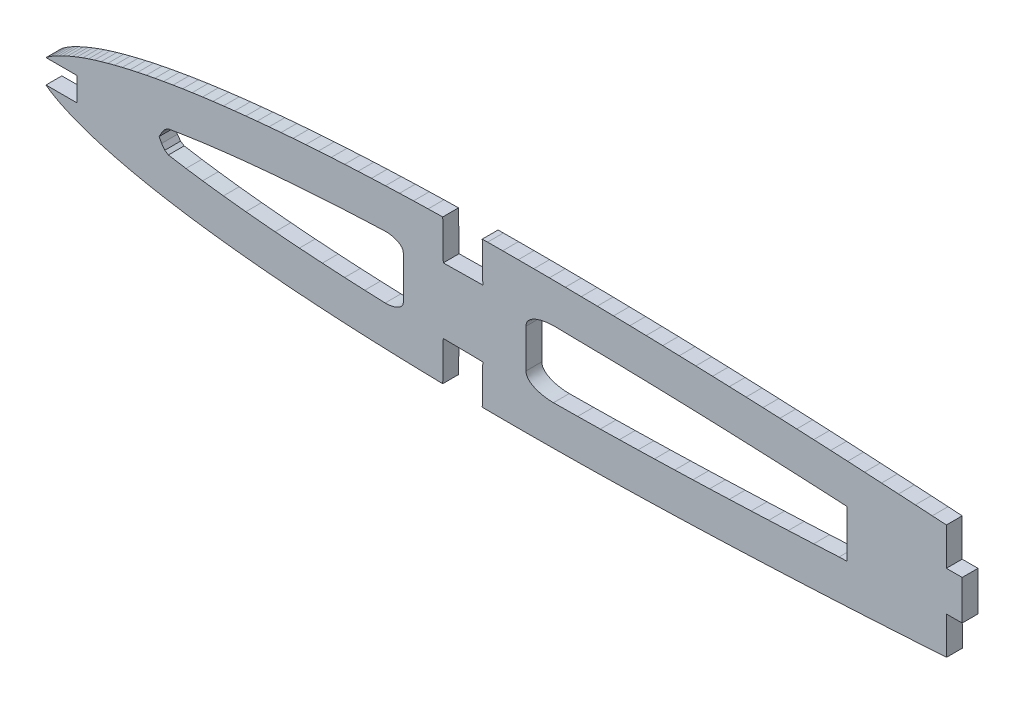
from build123d import *

# Parameters (mm, degrees)
EXTRUDE_1_DEPTH = 2


with BuildPart() as part:
    # Model → 凸台-拉伸1 (new body)
    with BuildSketch(Plane.XY):
        Polygon((163.647124705, -193.625837396), (167.570015682, -193.625837396), (167.570015682, -196.625837396), (163.648140211, -196.625837396), (163.699015682, -196.667837396), (164.036015682, -196.913837396), (164.386015682, -197.142837396), (164.844015682, -197.411837396), (165.313015682, -197.659837396), (165.790015682, -197.892837396), (166.383015682, -198.164837396), (166.981015682, -198.421837396), (167.586015682, -198.663837396), (168.307015682, -198.931837396), (169.035015682, -199.182837396), (169.767015682, -199.417837396), (170.616015682, -199.672837396), (171.469015682, -199.911837396), (172.326015682, -200.137837396), (173.297015682, -200.378837396), (174.271015682, -200.605837396), (175.249015682, -200.819837396), (176.339015682, -201.044837396), (177.432015682, -201.254837396), (178.527015682, -201.453837396), (179.731015682, -201.658837396), (180.937015682, -201.851837396), (182.145015682, -202.033837396), (183.459015682, -202.218837396), (184.774015682, -202.391837396), (186.091015682, -202.554837396), (187.510015682, -202.717837396), (188.930015682, -202.869837396), (190.351015682, -203.011837396), (191.868015682, -203.152837396), (193.385015682, -203.283837396), (194.904015682, -203.404837396), (196.513015682, -203.523837396), (198.123015682, -203.631837396), (199.733015682, -203.730837396), (201.429015682, -203.825837396), (203.125015682, -203.910837396), (204.821015682, -203.987837396), (206.596015682, -204.058837396), (208.371015682, -204.121837396), (210.147015682, -204.175837396), (211.994015682, -204.224837396), (213.841015682, -204.264837396), (213.909015682, -199.264837396), (218.909015682, -199.333837396), (218.840015682, -204.333837396), (219.513015682, -204.339837396), (221.426015682, -204.349837396), (223.396015682, -204.353837396), (225.366015682, -204.349837396), (227.336015682, -204.339837396), (229.355015682, -204.322837396), (231.374015682, -204.298837396), (233.393015682, -204.267837396), (235.455015682, -204.230837396), (237.515015682, -204.186837396), (239.576015682, -204.136837396), (241.671015682, -204.080837396), (243.766015682, -204.019837396), (245.861015682, -203.952837396), (247.981015682, -203.878837396), (250.100015682, -203.800837396), (252.220015682, -203.716837396), (254.358015682, -203.627837396), (256.495015682, -203.534837396), (258.632015682, -203.435837396), (260.778015682, -203.332837396), (262.922015682, -203.223837396), (265.067015682, -203.109837396), (267.212015682, -202.990837396), (269.357015682, -202.868837396), (271.502015682, -202.742837396), (273.640015682, -202.616837396), (275.777015682, -202.486837396), (277.580832126, -202.374573668), (277.564036383, -197.625837396), (279.564036383, -197.625837396), (279.564036383, -195.125837396), (279.564036383, -192.625837396), (277.564036383, -192.625837396), (277.564036383, -187.87589204), (275.777015682, -187.763837396), (273.640015682, -187.634837396), (271.502015682, -187.507837396), (269.357015682, -187.382837396), (267.212015682, -187.259837396), (265.067015682, -187.140837396), (262.922015682, -187.026837396), (260.778015682, -186.918837396), (258.632015682, -186.814837396), (256.495015682, -186.716837396), (254.358015682, -186.622837396), (252.220015682, -186.533837396), (250.100015682, -186.450837396), (247.981015682, -186.371837396), (245.861015682, -186.298837396), (243.766015682, -186.231837396), (241.671015682, -186.169837396), (239.576015682, -186.113837396), (237.515015682, -186.064837396), (235.455015682, -186.020837396), (233.393015682, -185.982837396), (231.374015682, -185.951837396), (229.355015682, -185.928837396), (227.336015682, -185.910837396), (225.366015682, -185.900837396), (223.396015682, -185.897837396), (221.426015682, -185.900837396), (219.513015682, -185.910837396), (218.840623844, -185.917828954), (218.910015682, -190.916837396), (213.910015682, -190.985837396), (213.841015682, -185.986837396), (211.994015682, -186.026837396), (210.147015682, -186.074837396), (208.371015682, -186.129837396), (206.596015682, -186.192837396), (204.821015682, -186.263837396), (203.125015682, -186.339837396), (201.429015682, -186.425837396), (199.733015682, -186.519837396), (198.123015682, -186.618837396), (196.513015682, -186.727837396), (194.904015682, -186.845837396), (193.385015682, -186.966837396), (191.868015682, -187.097837396), (190.351015682, -187.239837396), (188.930015682, -187.381837396), (187.510015682, -187.533837396), (186.091015682, -187.696837396), (184.774015682, -187.858837396), (183.459015682, -188.031837396), (182.145015682, -188.216837396), (180.937015682, -188.398837396), (179.731015682, -188.591837396), (178.527015682, -188.797837396), (177.432015682, -188.995837396), (176.339015682, -189.206837396), (175.249015682, -189.430837396), (174.271015682, -189.644837396), (173.297015682, -189.872837396), (172.326015682, -190.113837396), (171.469015682, -190.338837396), (170.616015682, -190.577837396), (169.767015682, -190.832837396), (169.035015682, -191.068837396), (168.307015682, -191.318837396), (167.586015682, -191.587837396), (166.981015682, -191.829837396), (166.383015682, -192.086837396), (165.790015682, -192.357837396), (165.313015682, -192.591837396), (164.844015682, -192.839837396), (164.386015682, -193.108837396), (164.036015682, -193.336837396), (163.699015682, -193.582837396), align=None)
        with BuildLine():
            Line((179.129015682, -193.694837396), (181.36252465, -193.334729257))
            Line((181.36252465, -193.334729257), (183.459015682, -193.031837396))
            Line((183.459015682, -193.031837396), (186.091015682, -192.696837396))
            Line((186.091015682, -192.696837396), (188.930015682, -192.381837396))
            Line((188.930015682, -192.381837396), (192.626515682, -192.032337396))
            Line((192.626515682, -192.032337396), (195.708515682, -191.786837396))
            Line((195.708515682, -191.786837396), (198.610220303, -191.588878851))
            Line((198.610220303, -191.588878851), (201.429015682, -191.425837396))
            Line((201.429015682, -191.425837396), (203.973015682, -191.301837396))
            Line((203.973015682, -191.301837396), (206.596015682, -191.192837396))
            add(Edge.make_bspline(
                [(206.596015682, -191.192837396), (207.448907991, -191.157395055), (208.849822606, -191.555139666), (208.849822606, -192.408768068)],
                knots=[0, 0, 0, 0, 2.560885208, 2.560885208, 2.560885208, 2.560885208], degree=3))
            Line((208.849822606, -192.408768068), (208.849822606, -197.842937396))
            add(Edge.make_bspline(
                [(206.556353674, -199.057189223), (207.420632302, -199.093104728), (208.849822606, -198.707961946), (208.849822606, -197.842937396)],
                knots=[0, 0, 0, 0, 2.595073648, 2.595073648, 2.595073648, 2.595073648], degree=3))
            Line((206.556353674, -199.057189223), (203.973015682, -198.949837396))
            Line((203.973015682, -198.949837396), (201.429015682, -198.825837396))
            Line((201.429015682, -198.825837396), (198.610220303, -198.662795941))
            Line((198.610220303, -198.662795941), (195.708515682, -198.464837396))
            Line((195.708515682, -198.464837396), (192.626515682, -198.219337396))
            Line((192.626515682, -198.219337396), (188.930015682, -197.869837396))
            Line((188.930015682, -197.869837396), (186.091015682, -197.554837396))
            Line((186.091015682, -197.554837396), (183.459015682, -197.219837396))
            Line((183.459015682, -197.219837396), (181.36252465, -196.916945536))
            Line((181.36252465, -196.916945536), (179.129015682, -196.556837396))
            Line((179.129015682, -196.556837396), (178.677186454, -196.264947511))
            Line((178.677186454, -196.264947511), (178.277501377, -195.713872479))
            Line((178.277501377, -195.713872479), (177.953943253, -195.125837396))
            Line((177.953943253, -195.125837396), (178.277501377, -194.537802313))
            Line((178.277501377, -194.537802313), (178.677186454, -193.986727282))
            Line((178.677186454, -193.986727282), (179.129015682, -193.694837396))
        make_face(mode=Mode.SUBTRACT)
        with BuildLine():
            Line((227.831221084, -190.896999719), (230.912256313, -190.946577136))
            Line((230.912256313, -190.946577136), (233.77958865, -190.989961437))
            Line((233.77958865, -190.989961437), (236.193513434, -191.036611135))
            Line((236.193513434, -191.036611135), (238.545515682, -191.089337396))
            Line((238.545515682, -191.089337396), (240.623515682, -191.141837396))
            Line((240.623515682, -191.141837396), (243.191604308, -191.21483811))
            Line((243.191604308, -191.21483811), (245.494786485, -191.287125054))
            Line((245.494786485, -191.287125054), (247.611545643, -191.359115079))
            Line((247.611545643, -191.359115079), (250.100015682, -191.450837396))
            Line((250.100015682, -191.450837396), (252.866227545, -191.560737703))
            Line((252.866227545, -191.560737703), (255.084259821, -191.654782623))
            Line((255.084259821, -191.654782623), (257.563515682, -191.765837396))
            Line((257.563515682, -191.765837396), (260.778015682, -191.918837396))
            Line((260.778015682, -191.918837396), (263.994515682, -192.083837396))
            Line((263.994515682, -192.083837396), (265.010753527, -192.143170467))
            Line((265.010753527, -192.143170467), (265.010753527, -198.139426475))
            Line((265.010753527, -198.139426475), (263.994515682, -198.167837397))
            Line((263.994515682, -198.167837397), (260.778015682, -198.332837397))
            Line((260.778015682, -198.332837397), (257.563515682, -198.485837397))
            Line((257.563515682, -198.485837397), (255.084259821, -198.59689217))
            Line((255.084259821, -198.59689217), (252.866227545, -198.69093709))
            Line((252.866227545, -198.69093709), (250.100015682, -198.800837397))
            Line((250.100015682, -198.800837397), (247.611545643, -198.892559714))
            Line((247.611545643, -198.892559714), (245.494786485, -198.964549739))
            Line((245.494786485, -198.964549739), (243.191604308, -199.036836683))
            Line((243.191604308, -199.036836683), (240.623515682, -199.109837397))
            Line((240.623515682, -199.109837397), (238.545515682, -199.162337397))
            Line((238.545515682, -199.162337397), (236.193513434, -199.215063658))
            Line((236.193513434, -199.215063658), (233.77958865, -199.261713356))
            Line((233.77958865, -199.261713356), (230.912256313, -199.305097657))
            Line((230.912256313, -199.305097657), (227.851142443, -199.336225141))
            add(Edge.make_bspline(
                [(224.381015683, -197.590929889), (224.381015683, -198.885698648), (226.55644062, -199.349390548), (227.851142443, -199.336225141)],
                knots=[0, 0, 0, 0, 3.884306276, 3.884306276, 3.884306276, 3.884306276], degree=3))
            Line((224.381015683, -197.590929889), (224.381015683, -192.68255464))
            add(Edge.make_bspline(
                [(224.381015683, -192.68255464), (224.365946189, -191.387689573), (226.536269729, -190.898902048), (227.831221084, -190.896999719)],
                knots=[0, 0, 0, 0, 3.884858258, 3.884858258, 3.884858258, 3.884858258], degree=3))
        make_face(mode=Mode.SUBTRACT)
    extrude(amount=EXTRUDE_1_DEPTH)


solid = part.part
